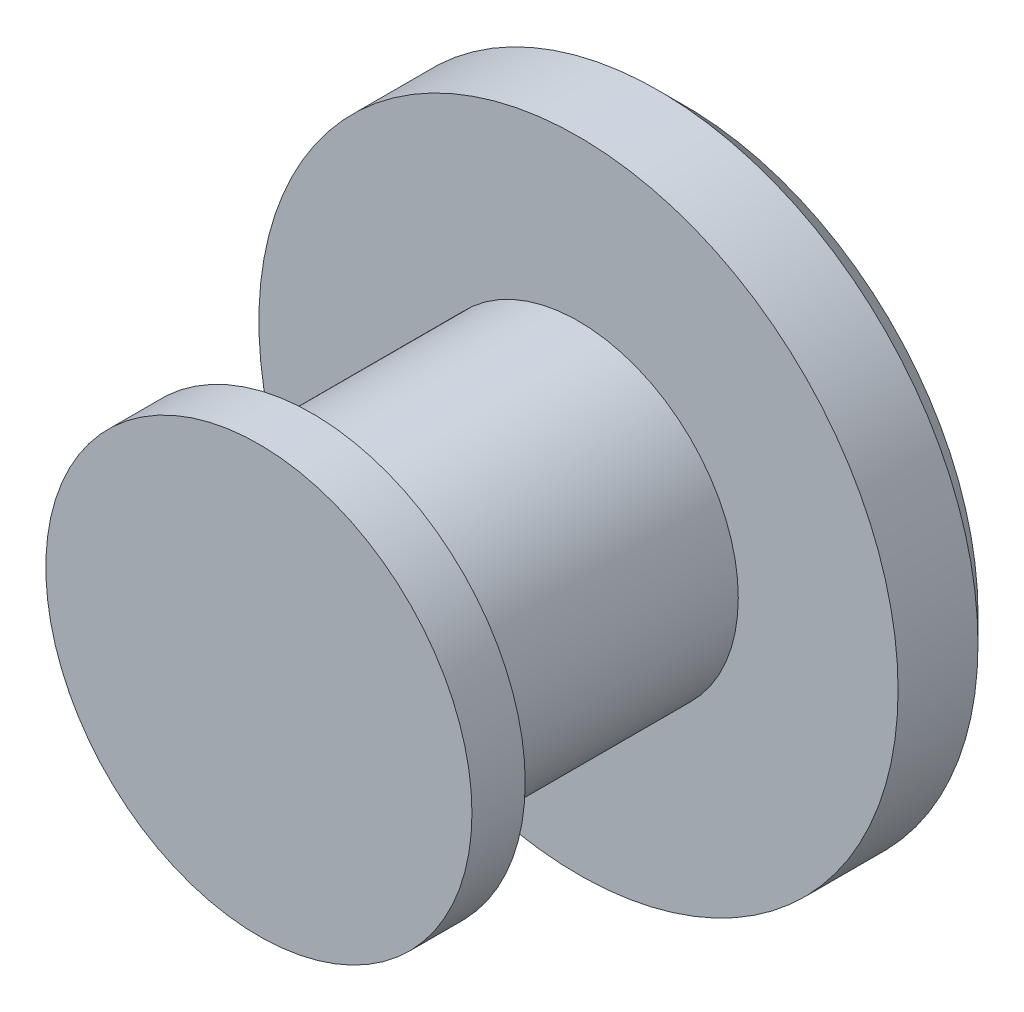
from build123d import *

# Parameters (mm, degrees)
SKETCH1_R           = 3
BOSS_EXTRUDE1_DEPTH = 5
BOSS_EXTRUDE2_START = 5
SKETCH1_3_R         = 4
SKETCH1_3_R_2       = 3
BOSS_EXTRUDE2_DEPTH = 1
BOSS_EXTRUDE3_START = -2
SKETCH1_4_R         = 6
SKETCH1_4_R_2       = 4
SKETCH1_4_R_3       = 3
BOSS_EXTRUDE3_DEPTH = 2
CHAMFER1_SIZE       = 0.5


with BuildPart() as part:
    # Sketch1 → Boss-Extrude1 (new body)
    with BuildSketch(Plane.XY):
        Circle(SKETCH1_R)
    extrude(amount=BOSS_EXTRUDE1_DEPTH)

    # Sketch1<3> → Boss-Extrude2 (add)
    # profile 1 of 2: a face of its own
    with BuildSketch(Plane.XY.offset(BOSS_EXTRUDE2_START)):
        Circle(SKETCH1_3_R)
        Circle(SKETCH1_3_R_2, mode=Mode.SUBTRACT)
    # profile 2 of 2: a face of its own
    with BuildSketch(Plane.XY.offset(BOSS_EXTRUDE2_START)):
        Circle(SKETCH1_3_R_2)
    extrude(amount=BOSS_EXTRUDE2_DEPTH)

    # Sketch1<4> → Boss-Extrude3 (add)
    # profile 1 of 3: a face of its own
    with BuildSketch(Plane.XY.offset(BOSS_EXTRUDE3_START)):
        Circle(SKETCH1_4_R)
        Circle(SKETCH1_4_R_2, mode=Mode.SUBTRACT)
    # profile 2 of 3: a face of its own
    with BuildSketch(Plane.XY.offset(BOSS_EXTRUDE3_START)):
        Circle(SKETCH1_4_R_2)
        Circle(SKETCH1_4_R_3, mode=Mode.SUBTRACT)
    # profile 3 of 3: a face of its own
    with BuildSketch(Plane.XY.offset(BOSS_EXTRUDE3_START)):
        Circle(SKETCH1_4_R_3)
    extrude(amount=BOSS_EXTRUDE3_DEPTH)

    # Chamfer1
    chamfer1_edges = [part.edges().sort_by_distance(p)[0] for p in [
        (-6, 0, -2),
    ]]
    chamfer(chamfer1_edges, length=CHAMFER1_SIZE)


solid = part.part
